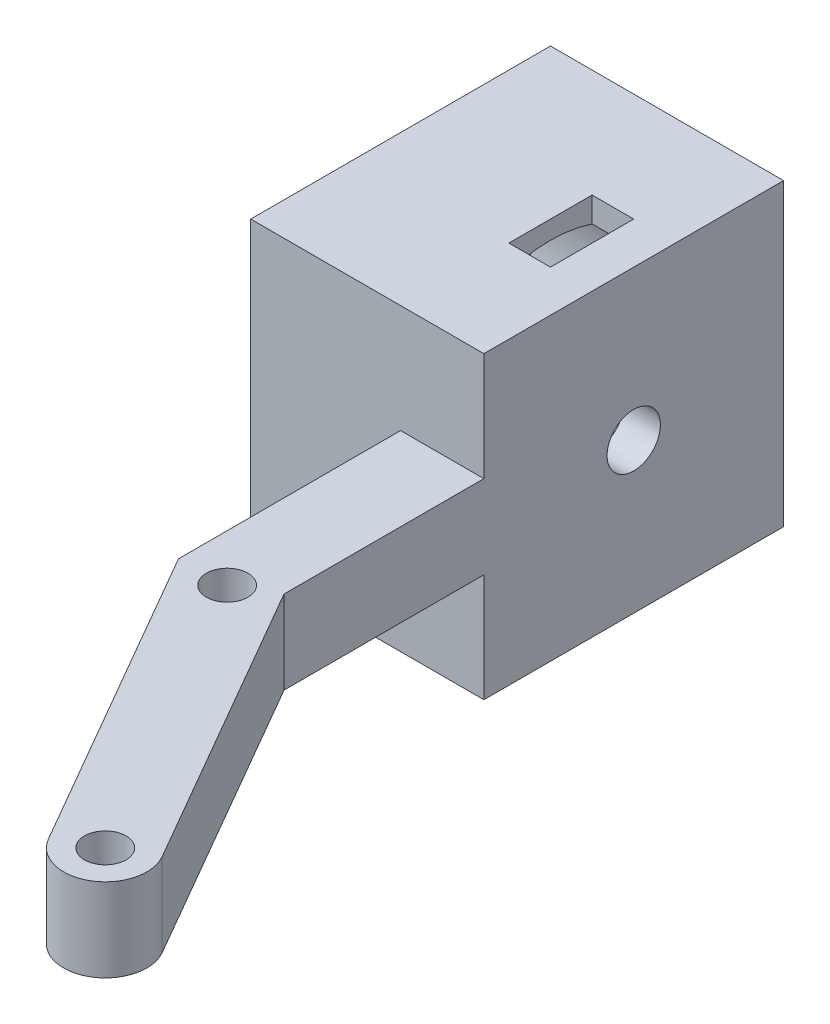
from build123d import *

# Parameters (mm, degrees)
SKETCH1_R               = 1.5875
BOSS_EXTRUDE1_DEPTH     = 22.86
TOP_CUT_DEPTH           = 8.255
BOTTOM_CUT_DEPTH        = 8.255
SKETCH5_R               = 10.033
CUT_EXTRUDE1_DEPTH      = 14.986
SKETCH7_R               = 2.032
CUT_EXTRUDE2_DEPTH      = 49.946539324
CUT_EXTRUDE3_REACH      = 50.947
CUT_EXTRUDE3_END_RADIUS = 10.033
SKETCH8_W               = 3.175
SKETCH8_H               = 6.35


with BuildPart() as part:
    # Sketch1 → Boss-Extrude1 (new body)
    with BuildSketch(Plane(origin=(0, 0, 0), x_dir=(1, 0, 0), z_dir=(0, 1, 0))):
        with BuildLine():
            Line((-6.35, -14.401477372), (-6.35, 2.54))
            Line((-6.35, 2.54), (-17.78, 2.54))
            Line((-17.78, 2.54), (-17.78, 25.4))
            Line((-17.78, 25.4), (0, 25.4))
            Line((0, 25.4), (0, -12.7))
            Line((0, -12.7), (12.7, -34.697045256))
            ThreePointArc((12.7, -34.697045256), (11.537869343, -39.034175913), (7.200738686, -37.872045256))
            Line((7.200738686, -37.872045256), (-6.35, -14.401477372))
        make_face()
        with Locations(Location((9.950369343, -36.284545256, 0), (0, 0, 270))):
            Circle(SKETCH1_R, mode=Mode.SUBTRACT)
        with Locations(Location((-2.749630657, -14.2875, 0), (0, 0, 270))):
            Circle(SKETCH1_R, mode=Mode.SUBTRACT)
    extrude(amount=BOSS_EXTRUDE1_DEPTH)

    # Sketch2 → Top Cut (cut)
    with BuildSketch(Plane(origin=(0, 22.86, 0), x_dir=(1, 0, 0), z_dir=(0, 1, 0))):
        Polygon((-6.35, -14.401477372), (8.788238686, -40.621675913), (14.2875, -37.446675913), (0, -12.7), (0, 2.54), (-6.35, 2.54), align=None)
    extrude(amount=-TOP_CUT_DEPTH, mode=Mode.SUBTRACT)

    # Sketch4 → Bottom Cut (cut)
    with BuildSketch(Plane.XZ):
        Polygon((-6.35, -2.54), (-6.35, 14.401477372), (8.788238686, 40.621675913), (14.2875, 37.446675913), (0, 12.7), (0, -2.54), align=None)
    extrude(amount=-BOTTOM_CUT_DEPTH, mode=Mode.SUBTRACT)

    # Sketch5 → Cut-Extrude1 (cut)
    with BuildSketch(Plane.ZY.offset(17.78)):
        with Locations((-13.97, 11.43)):
            Circle(SKETCH5_R)
    extrude(amount=-CUT_EXTRUDE1_DEPTH, mode=Mode.SUBTRACT)

    # Sketch7 → Cut-Extrude2 (cut, through all)
    with BuildSketch(Plane(origin=(0, 0, 0), x_dir=(0, 0, -1), z_dir=(1, 0, 0))):
        with Locations((13.97, 11.43)):
            Circle(SKETCH7_R)
    extrude(amount=-CUT_EXTRUDE2_DEPTH, mode=Mode.SUBTRACT)

    # Cut-Extrude3: up to this cylinder (the profile starts outside it)
    cut_extrude3_end = Plane(origin=(-4.7625, 11.43, -13.97), z_dir=(-1, 0, 0)) * Cylinder(CUT_EXTRUDE3_END_RADIUS, 122.96, mode=Mode.PRIVATE)
    # Sketch8 → Cut-Extrude3 (cut, up to the surface)
    with BuildSketch(Plane(origin=(0, 22.86, 0), x_dir=(1, 0, 0), z_dir=(0, 1, 0)), mode=Mode.PRIVATE) as cut_extrude3_sk1:
        with Locations((-4.7625, 13.97)):
            Rectangle(SKETCH8_W, SKETCH8_H)
    cut_extrude3_tool1 = extrude(cut_extrude3_sk1.sketch, amount=-CUT_EXTRUDE3_REACH, mode=Mode.PRIVATE) - cut_extrude3_end
    add(cut_extrude3_tool1.solids().sort_by_distance((-4.7625, 22.86, -13.97))[0], mode=Mode.SUBTRACT)


solid = part.part
